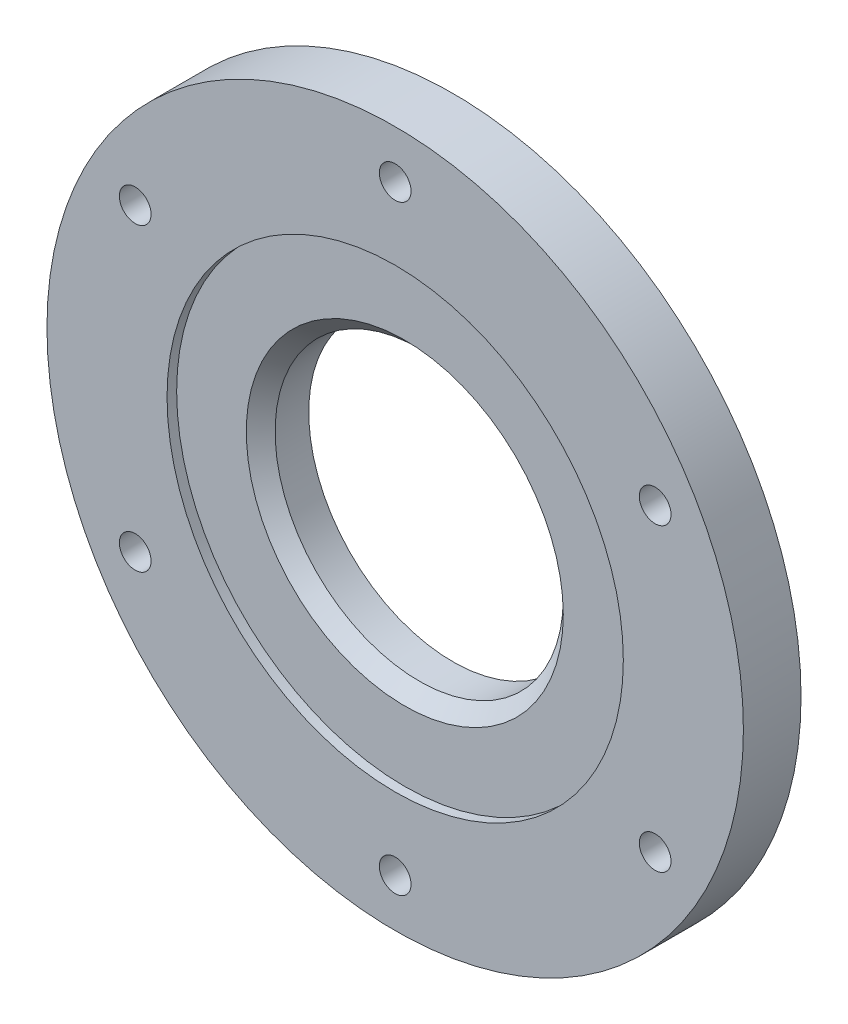
from build123d import *

# Parameters (mm, degrees)
SKETCH1_R            = 72.5
SKETCH1_R_2          = 30
BOSS_EXTRUDE1_DEPTH  = 12
M6_CLEARANCE_HOLE1_D = 6.6
CIRPATTERN1_COUNT    = 6
SKETCH4_R            = 47.5
CUT_EXTRUDE1_DEPTH   = 2
CHAMFER1_SIZE        = 3


with BuildPart() as part:
    # Sketch1 → Boss-Extrude1 (new body)
    with BuildSketch(Plane.XY):
        Circle(SKETCH1_R)
        Circle(SKETCH1_R_2, mode=Mode.SUBTRACT)
    extrude(amount=-BOSS_EXTRUDE1_DEPTH)

    # M6 Clearance Hole1 (through all)
    with Locations(Plane(origin=(9.54608016, 92.530972723, -12), x_dir=(1, 0, 0), z_dir=(0, 0, -1))):
        with Locations((-9.54608016, 30.030972723)):
            m6_clearance_hole1 = Hole(M6_CLEARANCE_HOLE1_D / 2)

    # CirPattern1: M6 Clearance Hole1 ×6 about axis
    cirpattern1_axis = Axis((0, 0, 0), (0, 0, 1))
    for i in range(1, CIRPATTERN1_COUNT):
        add(m6_clearance_hole1.rotate(cirpattern1_axis, i * 360 / CIRPATTERN1_COUNT), mode=Mode.SUBTRACT)

    # Sketch4 → Cut-Extrude1 (cut)
    with BuildSketch(Plane.XY):
        Circle(SKETCH4_R)
    extrude(amount=-CUT_EXTRUDE1_DEPTH, mode=Mode.SUBTRACT)

    # Chamfer1
    chamfer1_edges = [part.edges().sort_by_distance(p)[0] for p in [
        (-30, 0, -2),
    ]]
    chamfer(chamfer1_edges, length=CHAMFER1_SIZE)


solid = part.part
